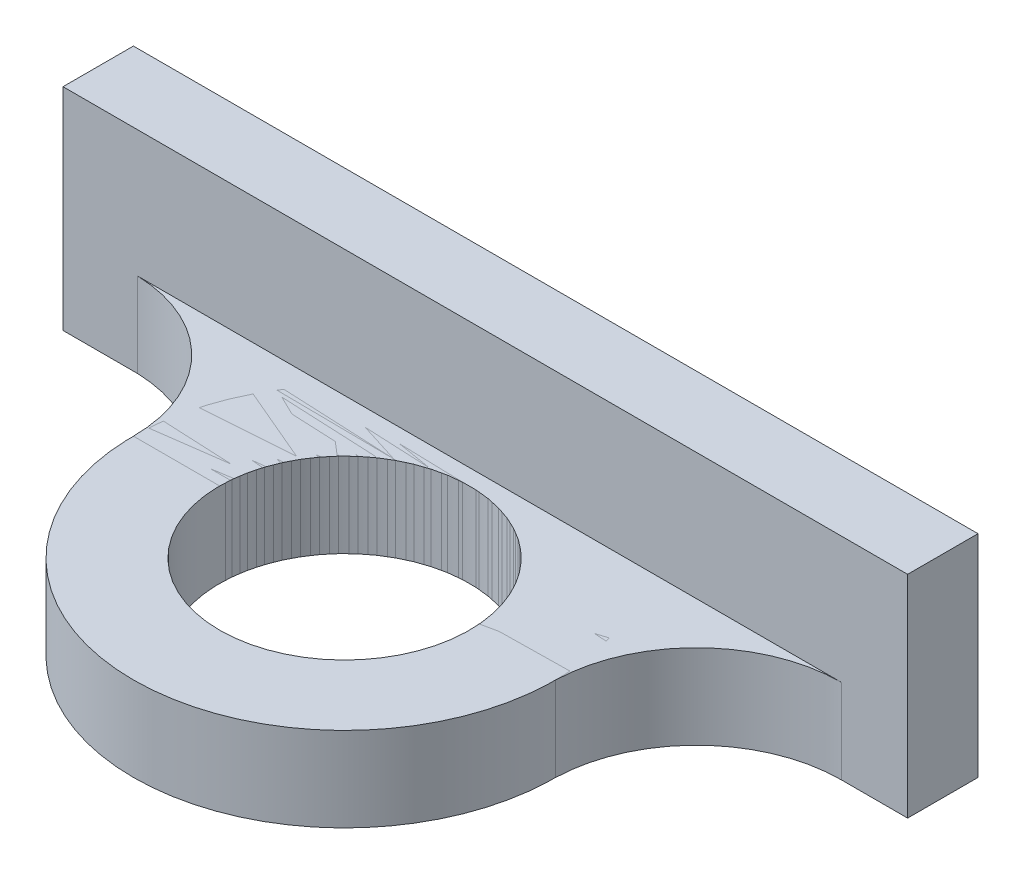
from build123d import *

# Parameters (mm, degrees)
SKETCH1_R           = 30
SKETCH1_R_2         = 17.75
BOSS_EXTRUDE1_DEPTH = 12
BOSS_EXTRUDE2_DEPTH = 30
BOSS_EXTRUDE3_DEPTH = 12


with BuildPart() as part:
    # Sketch1 → Boss-Extrude1 (new body)
    with BuildSketch(Plane(origin=(0, 0, 0), x_dir=(1, 0, 0), z_dir=(0, 1, 0))):
        with Locations(Location((0, 0, 0), (0, 0, 270))):
            Circle(SKETCH1_R)
        with Locations(Location((0, 0, 0), (0, 0, 270))):
            Circle(SKETCH1_R_2, mode=Mode.SUBTRACT)
    extrude(amount=BOSS_EXTRUDE1_DEPTH)

    # Sketch5 → Boss-Extrude2 (add)
    with BuildSketch(Plane.XZ):
        Polygon((0, -30), (60, -30), (60, -20), (0, -20), (-60, -20), (-60, -30), align=None)
    extrude(amount=-BOSS_EXTRUDE2_DEPTH)


with BuildPart() as body_2:
    # Sketch6 → Boss-Extrude3 (new body)
    with BuildSketch(Plane.XZ):
        with BuildLine():
            ThreePointArc((-30, 0), (-28.025170769, -10.704662693), (-22.360679775, -20))
            Line((-22.360679775, -20), (22.360679775, -20))
            ThreePointArc((22.360679775, -20), (28.025170769, -10.704662693), (30, 0))
            Line((30, 0), (17.75, 0))
            ThreePointArc((17.75, 0), (0, -17.75), (-17.75, 0))
            Line((-17.75, 0), (-30, 0))
        make_face()
        with BuildLine():
            ThreePointArc((30, 0), (28.025170769, -10.704662693), (22.360679775, -20))
            Line((22.360679775, -20), (50.590169944, -20))
            ThreePointArc((50.590169944, -20), (36.237860911, -14.176946646), (30, 0))
        make_face()
        with BuildLine():
            Line((-49.426745923, -20), (-22.360679775, -20))
            ThreePointArc((-22.360679775, -20), (-28.025170769, -10.704662693), (-30, 0))
            ThreePointArc((-30, 0), (-35.6561489, -13.940933049), (-49.426745923, -20))
        make_face()
    extrude(amount=-BOSS_EXTRUDE3_DEPTH)


solid = Compound([part.part, body_2.part])
